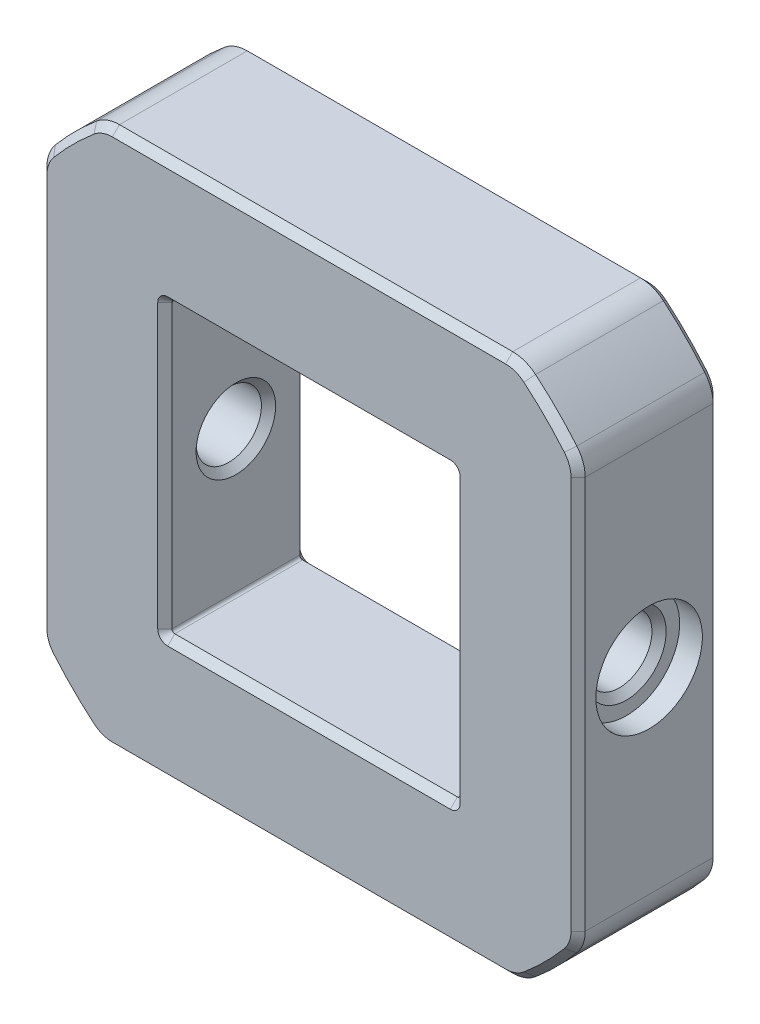
from build123d import *

# Parameters (mm, degrees)
SKIZZE1_W                       = 20.3
SKIZZE1_H                       = 20.3
AUFSATZ_LINEAR_AUSTRAGEN1_DEPTH = 10
VERRUNDUNG1_R                   = 0.2
VERRUNDUNG2_R                   = 2.5
SKIZZE2_R                       = 2.3
SCHNITT_LINEAR_AUSTRAGEN1_DEPTH = 44.53748385
SKETCH1_R                       = 3.75
CUT_EXTRUDE1_DEPTH              = 1.6
CUT_EXTRUDE2_START              = -36.3
SKETCH1_2_R                     = 3.75
CUT_EXTRUDE2_DEPTH              = 1.6
FASE2_SIZE                      = 0.5


with BuildPart() as part:
    # Skizze1 → Aufsatz-Linear austragen1 (new body)
    with BuildSketch(Plane.XY):
        with BuildLine():
            Line((14.727440375, 18.95), (-14.727440375, 18.95))
            ThreePointArc((-14.727440375, 18.95), (-16.970562748, 16.970562748), (-18.95, 14.727440375))
            Line((-18.95, 14.727440375), (-18.95, -14.727440375))
            ThreePointArc((-18.95, -14.727440375), (-16.970562748, -16.970562748), (-14.727440375, -18.95))
            Line((-14.727440375, -18.95), (14.727440375, -18.95))
            ThreePointArc((14.727440375, -18.95), (16.970562748, -16.970562748), (18.95, -14.727440375))
            Line((18.95, -14.727440375), (18.95, 14.727440375))
            ThreePointArc((18.95, 14.727440375), (16.970562748, 16.970562748), (14.727440375, 18.95))
        make_face()
        Rectangle(SKIZZE1_W, SKIZZE1_H, mode=Mode.SUBTRACT)
    extrude(amount=AUFSATZ_LINEAR_AUSTRAGEN1_DEPTH)

    # Verrundung1
    verrundung1_edges = [part.edges().sort_by_distance(p)[0] for p in [
        (10.15, -10.15, 5),
        (10.15, 10.15, 5),
        (-10.15, 10.15, 5),
        (-10.15, -10.15, 5),
    ]]
    fillet(verrundung1_edges, radius=VERRUNDUNG1_R)

    # Verrundung2
    verrundung2_edges = [part.edges().sort_by_distance(p)[0] for p in [
        (18.95, 14.727440375, 5),
        (18.95, -14.727440375, 5),
        (14.727440375, -18.95, 5),
        (-14.727440375, -18.95, 5),
        (-18.95, -14.727440375, 5),
        (-18.95, 14.727440375, 5),
        (-14.727440375, 18.95, 5),
        (14.727440375, 18.95, 5),
    ]]
    fillet(verrundung2_edges, radius=VERRUNDUNG2_R)

    # Skizze2 → Schnitt-Linear austragen1 (cut, through all)
    with BuildSketch(Plane(origin=(18.95, 0, 0), x_dir=(0, 0, -1), z_dir=(1, 0, 0))):
        with Locations(Location((-5, 0, 0), (0, 0, 90))):
            Circle(SKIZZE2_R)
    extrude(amount=-SCHNITT_LINEAR_AUSTRAGEN1_DEPTH, mode=Mode.SUBTRACT)

    # Sketch1 → Cut-Extrude1 (cut)
    with BuildSketch(Plane.ZY.offset(18.95)):
        with Locations(Location((5, 0, 0), (0, 0, 270))):
            Circle(SKETCH1_R)
    extrude(amount=-CUT_EXTRUDE1_DEPTH, mode=Mode.SUBTRACT)

    # Sketch1<2> → Cut-Extrude2 (cut)
    with BuildSketch(Plane.ZY.offset(18.95).offset(CUT_EXTRUDE2_START)):
        with Locations(Location((5, 0, 0), (0, 0, 270))):
            Circle(SKETCH1_2_R)
    extrude(amount=-CUT_EXTRUDE2_DEPTH, mode=Mode.SUBTRACT)

    # Fase2
    fase2_edges = [part.edges().sort_by_distance(p)[0] for p in [
        (-10.15, -2.3, 5),
        (10.15, -2.3, 5),
        (-17.35, -2.3, 5),
        (17.35, -2.3, 5),
        (0, -10.15, 0),
        (0, -10.15, 10),
        (10.15, 0, 0),
        (10.15, 0, 10),
        (-10.15, 0, 0),
        (-10.15, 0, 10),
        (0, 10.15, 0),
        (0, 10.15, 10),
        (10.091421356, -10.091421356, 0),
        (10.091421356, -10.091421356, 10),
        (-10.091421356, -10.091421356, 0),
        (-10.091421356, -10.091421356, 10),
        (-10.091421356, 10.091421356, 0),
        (-10.091421356, 10.091421356, 10),
        (10.091421356, 10.091421356, 0),
        (10.091421356, 10.091421356, 10),
        (0, 18.95, 0),
        (0, 18.95, 10),
        (16.970562748, 16.970562748, 0),
        (18.95, 0, 0),
        (16.970562748, -16.970562748, 0),
        (0, -18.95, 0),
        (-16.970562748, -16.970562748, 0),
        (-18.95, 0, 0),
        (-16.970562748, 16.970562748, 0),
        (-14.700425655, 18.798614139, 0),
        (-18.798614139, 14.700425655, 0),
        (-18.798614139, -14.700425655, 0),
        (-14.700425655, -18.798614139, 0),
        (14.700425655, -18.798614139, 0),
        (18.798614139, -14.700425655, 0),
        (18.798614139, 14.700425655, 0),
        (14.700425655, 18.798614139, 0),
        (16.970562748, 16.970562748, 10),
        (-16.970562748, 16.970562748, 10),
        (-18.95, 0, 10),
        (-16.970562748, -16.970562748, 10),
        (0, -18.95, 10),
        (16.970562748, -16.970562748, 10),
        (18.95, 0, 10),
        (-14.700425655, 18.798614139, 10),
        (-18.798614139, 14.700425655, 10),
        (-18.798614139, -14.700425655, 10),
        (-14.700425655, -18.798614139, 10),
        (14.700425655, -18.798614139, 10),
        (18.798614139, -14.700425655, 10),
        (18.798614139, 14.700425655, 10),
        (14.700425655, 18.798614139, 10),
    ]]
    chamfer(fase2_edges, length=FASE2_SIZE)


solid = part.part
